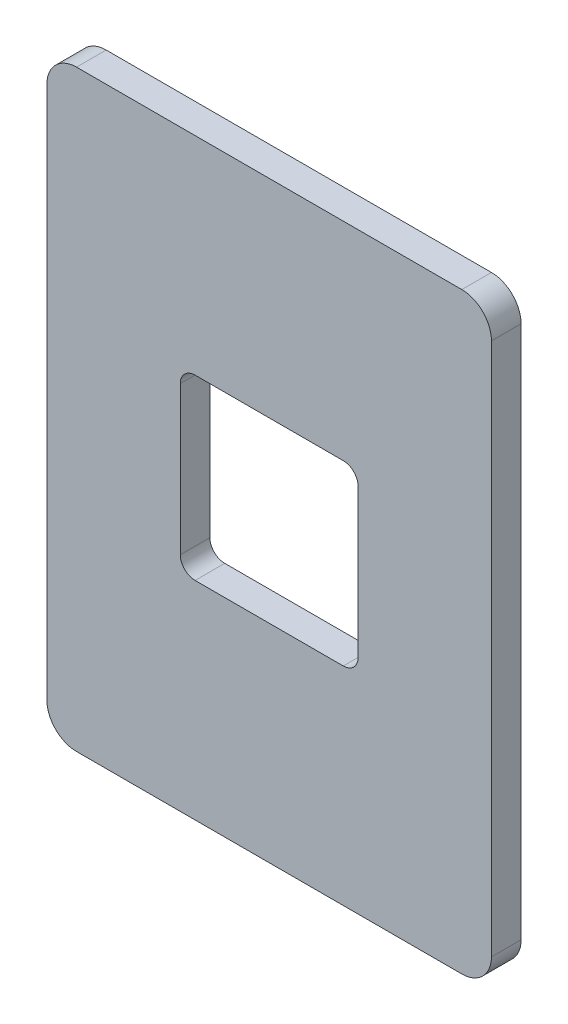
from build123d import *

# Parameters (mm, degrees)
ESQUISSE1_W             = 30
ESQUISSE1_H             = 40
BOSS_EXTRU_1_DEPTH      = 2
CONG_1_R                = 2
ESQUISSE3_W             = 12
ESQUISSE3_H             = 12
ENL_V_MAT_EXTRU_1_DEPTH = 10
CONG_2_R                = 1


with BuildPart() as part:
    # Esquisse1 → Boss.-Extru.1 (new body)
    with BuildSketch(Plane.XY):
        Rectangle(ESQUISSE1_W, ESQUISSE1_H)
    extrude(amount=BOSS_EXTRU_1_DEPTH)

    # Congé1
    cong_1_edges = [part.edges().sort_by_distance(p)[0] for p in [
        (15, -20, 1),
        (-15, -20, 1),
        (-15, 20, 1),
        (15, 20, 1),
    ]]
    fillet(cong_1_edges, radius=CONG_1_R)

    # Esquisse3 → Enlèv. mat.-Extru.1 (cut)
    with BuildSketch(Plane(origin=(0, 0, 0), x_dir=(-1, 0, 0), z_dir=(0, 0, -1))):
        Rectangle(ESQUISSE3_W, ESQUISSE3_H)
    extrude(amount=-ENL_V_MAT_EXTRU_1_DEPTH, mode=Mode.SUBTRACT)

    # Congé2
    cong_2_edges = [part.edges().sort_by_distance(p)[0] for p in [
        (-6, 6, 1),
        (-6, -6, 1),
        (6, -6, 1),
        (6, 6, 1),
    ]]
    fillet(cong_2_edges, radius=CONG_2_R)


solid = part.part
